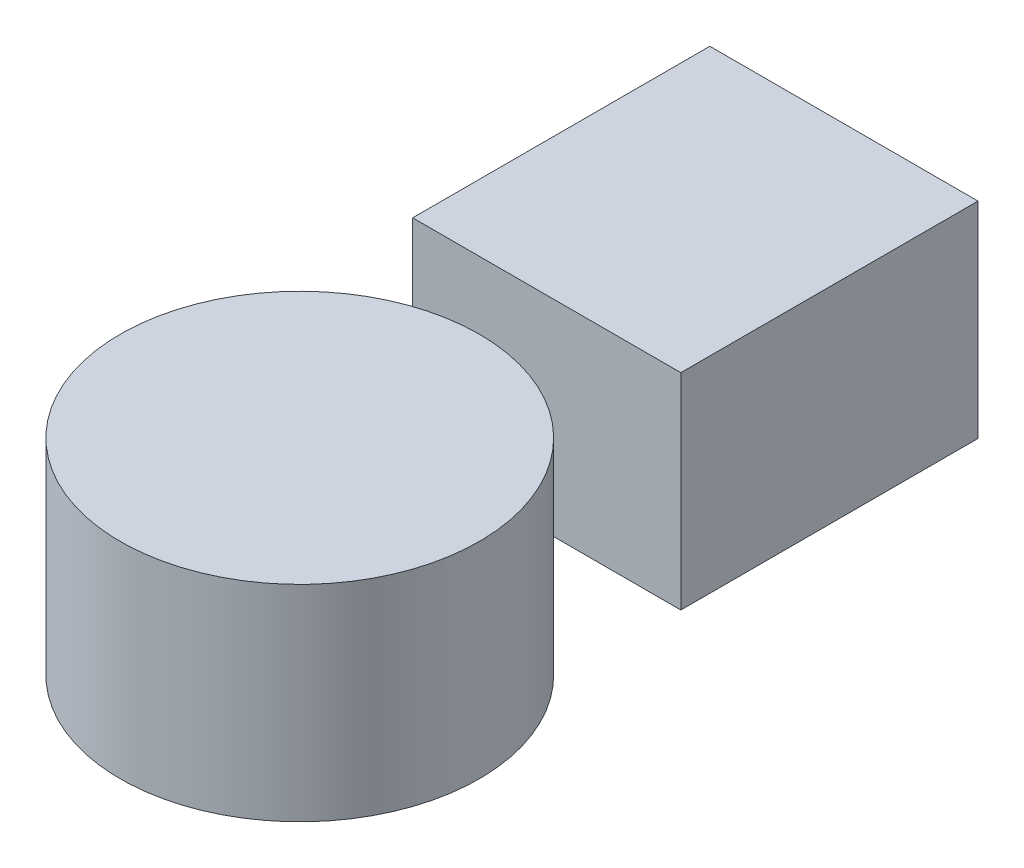
from build123d import *

# Parameters (mm, degrees)
SKETCH1_W           = 58.68704402
SKETCH1_H           = 67.209255033
SKETCH2_W           = 87.660679444
SKETCH2_H           = 97.137509655
BOSS_EXTRUDE1_DEPTH = 67.209255033


with BuildPart() as part:
    # Sketch1 → Revolve1 (revolve)
    with BuildSketch(Plane.XY, mode=Mode.PRIVATE) as revolve1_sk:
        with Locations((29.34352201, 33.604627517)):
            Rectangle(SKETCH1_W, SKETCH1_H)
    revolve(revolve1_sk.sketch.rotate(Axis((0, 0, 0), (0, 1, 0)), 90), axis=Axis((0, 0, 0), (0, 1, 0)))


with BuildPart() as body_2:
    # Sketch2 → Boss-Extrude1 (new body)
    with BuildSketch(Plane(origin=(0, 0, 0), x_dir=(1, 0, 0), z_dir=(0, 1, 0))):
        with Locations((0, 129.298002943)):
            Rectangle(SKETCH2_W, SKETCH2_H)
    extrude(amount=BOSS_EXTRUDE1_DEPTH)


solid = Compound([part.part, body_2.part])
